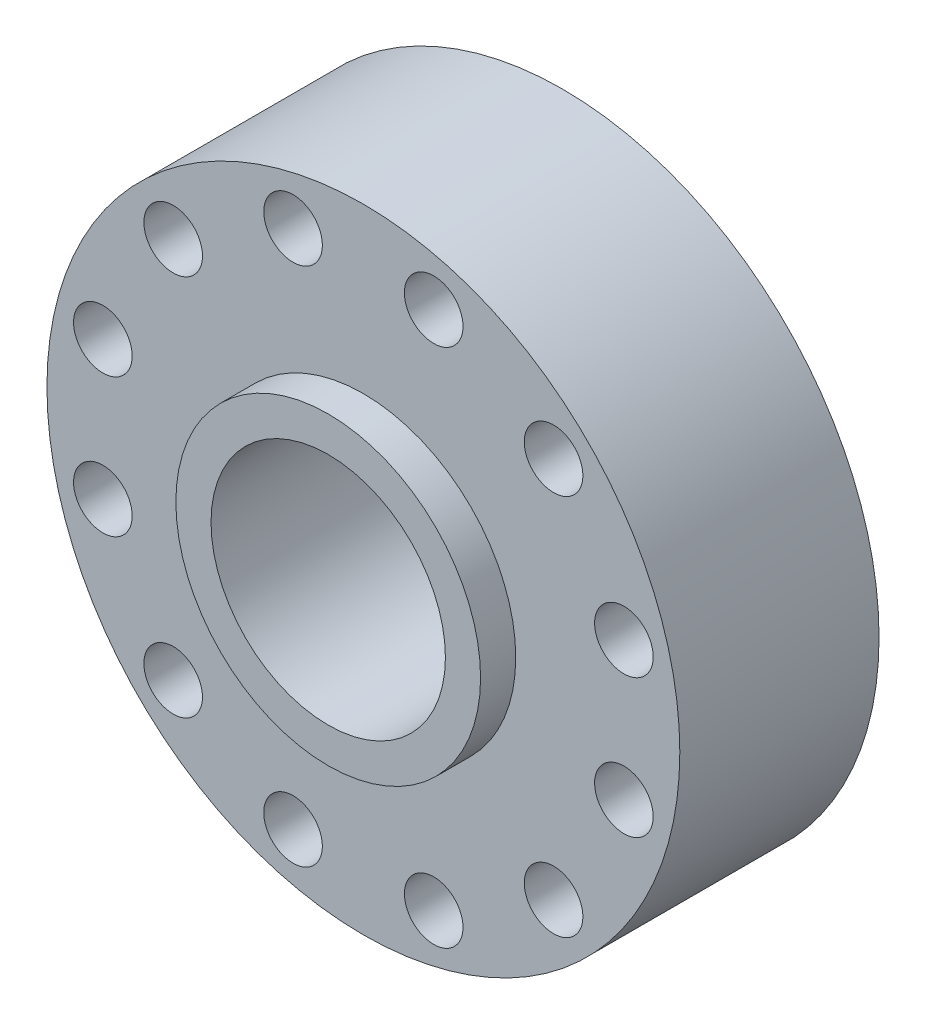
from build123d import *

# Parameters (mm, degrees)
SKETCH_3_R               = 27
EXTRUDE_1_DEPTH          = 8.5
SKETCH_5_R               = 13
CUT_EXTRUDE_2_DEPTH      = 42.797129088
SKETCH_8_R               = 13
SKETCH_8_R_2             = 10
EXTRUDE_2_DEPTH          = 11.5
CUT_EXTRUDE_3_REACH      = 45.105
SKETCH_9_R               = 2.5
PATTERN_CIRCULAR_2_COUNT = 6


with BuildPart() as part:
    # 草图3 → 凸台-拉伸1 (new, symmetric)
    with BuildSketch(Plane.XY):
        Circle(SKETCH_3_R)
    extrude(amount=EXTRUDE_1_DEPTH, both=True)

    # 草图5 → 切除-拉伸2 (cut, through all)
    with BuildSketch(Plane(origin=(0, 0, -8.5), x_dir=(-1, 0, 0), z_dir=(0, 0, -1))):
        Circle(SKETCH_5_R)
    extrude(amount=-CUT_EXTRUDE_2_DEPTH, mode=Mode.SUBTRACT)

    # 草图8 → 凸台-拉伸2 (add, symmetric)
    with BuildSketch(Plane.XY):
        with Locations(Location((0, 0, 0), (0, 0, 180))):
            Circle(SKETCH_8_R)
        Circle(SKETCH_8_R_2, mode=Mode.SUBTRACT)
    extrude(amount=EXTRUDE_2_DEPTH, both=True)

    # 草图9 → 切除-拉伸3 (cut, up to next)
    with BuildSketch(Plane(origin=(0, 0, -8.5), x_dir=(-1, 0, 0), z_dir=(0, 0, -1)), mode=Mode.PRIVATE) as cut_extrude_3_sk1:
        with Locations((-6, 22.203603311)):
            Circle(SKETCH_9_R)
    cut_extrude_3_tool1 = extrude(cut_extrude_3_sk1.sketch, amount=-CUT_EXTRUDE_3_REACH, mode=Mode.PRIVATE) & part.part
    # 草图9 → 切除-拉伸3 (cut, up to next)
    with BuildSketch(Plane(origin=(0, 0, -8.5), x_dir=(-1, 0, 0), z_dir=(0, 0, -1)), mode=Mode.PRIVATE) as cut_extrude_3_sk2:
        with Locations((6, 22.203603311)):
            Circle(SKETCH_9_R)
    cut_extrude_3_tool2 = extrude(cut_extrude_3_sk2.sketch, amount=-CUT_EXTRUDE_3_REACH, mode=Mode.PRIVATE) & part.part
    cut_extrude_3_1 = cut_extrude_3_tool1.solids().sort_by_distance((6, 22.203603, -8.5))[0]
    add(cut_extrude_3_1, mode=Mode.SUBTRACT)
    cut_extrude_3_2 = cut_extrude_3_tool2.solids().sort_by_distance((-6, 22.203603, -8.5))[0]
    add(cut_extrude_3_2, mode=Mode.SUBTRACT)
    cut_extrude_3 = cut_extrude_3_1 + cut_extrude_3_2  # 切除-拉伸3 as one shape, for the pattern or mirror that repeats it

    # 阵列(圆周)2: 切除-拉伸3 ×6 about axis
    pattern_circular_2_axis = Axis((0, 0, 0), (0, 0, 1))
    for i in range(1, PATTERN_CIRCULAR_2_COUNT):
        add(cut_extrude_3.rotate(pattern_circular_2_axis, i * 360 / PATTERN_CIRCULAR_2_COUNT), mode=Mode.SUBTRACT)


solid = part.part
